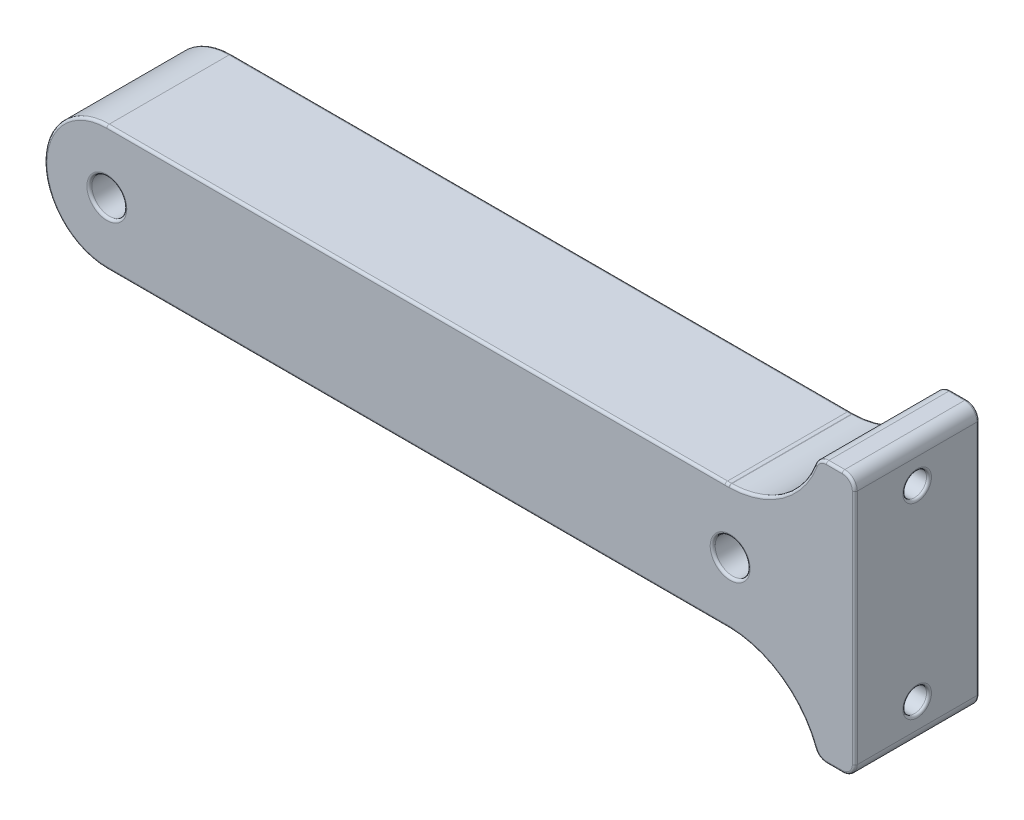
from build123d import *

# Parameters (mm, degrees)
EXTRUDE_1_DEPTH      = 5
EXTRUDE_1_DEPTH_BACK = 5
SKETCH_1_R           = 1.4
SKETCH_2_R           = 0.95
CUT_EXTRUDE_1_DEPTH  = 67.03218912
FILLET_1_R           = 0.2


with BuildPart() as part:
    # 스케치1 → 보스-돌출1 (new, two sides: drawn at the far end of the back side and taken through both)
    with BuildSketch(Plane.XY.offset(-EXTRUDE_1_DEPTH_BACK)):
        with BuildLine():
            ThreePointArc((-25, 5), (-30, 0), (-25, -5))
            Line((-25, -5), (24.593629003, -5))
            ThreePointArc((24.593629003, -5), (28.964550408, -6.279850585), (31.789043043, -9.852694383))
            ThreePointArc((31.789043043, -9.852694383), (32.155876693, -10.322403302), (32.724781613, -10.5))
            Line((32.724781613, -10.5), (34, -10.5))
            ThreePointArc((34, -10.5), (34.707106781, -10.207106781), (35, -9.5))
            Line((35, -9.5), (35, 9.5))
            ThreePointArc((35, 9.5), (34.707106781, 10.207106781), (34, 10.5))
            Line((34, 10.5), (32.724781613, 10.5))
            ThreePointArc((32.724781613, 10.5), (32.155876693, 10.322403302), (31.789043043, 9.852694383))
            ThreePointArc((31.789043043, 9.852694383), (28.964550408, 6.279850585), (24.593629003, 5))
            Line((24.593629003, 5), (-25, 5))
        make_face()
        with Locations((-25, 0)):
            Circle(SKETCH_1_R, mode=Mode.SUBTRACT)
        with Locations((25, 0)):
            Circle(SKETCH_1_R, mode=Mode.SUBTRACT)
    extrude(amount=EXTRUDE_1_DEPTH + EXTRUDE_1_DEPTH_BACK)

    # 스케치2 → 컷-돌출1 (cut, through all)
    with BuildSketch(Plane(origin=(35, 0, 0), x_dir=(0, 0, -1), z_dir=(1, 0, 0))):
        with Locations(Location((0, 7.5, 0), (0, 0, 90))):
            Circle(SKETCH_2_R)
        with Locations(Location((0, -7.5, 0), (0, 0, 90))):
            Circle(SKETCH_2_R)
    extrude(amount=-CUT_EXTRUDE_1_DEPTH, mode=Mode.SUBTRACT)

    # 필렛1
    fillet_1_edges = [part.edges().sort_by_distance(p)[0] for p in [
        (35, -8.45, 0),
        (31.084836779, -8.45, 0),
        (29.339642378, 6.55, 0),
        (35, 6.55, 0),
        (-26.4, 0, -5),
        (-26.4, 0, 5),
        (23.6, 0, -5),
        (23.6, 0, 5),
        (28.964550408, 6.279850585, 5),
        (28.964550408, 6.279850585, -5),
        (28.964550408, 6.279850585, -5),
        (28.964550408, 6.279850585, 5),
        (-0.203185498, 5, 5),
        (-0.203185498, 5, -5),
        (-30, 0, 5),
        (-30, 0, -5),
        (-0.203185498, -5, 5),
        (-0.203185498, -5, -5),
        (28.964550408, -6.279850585, 5),
        (28.964550408, -6.279850585, -5),
        (28.964550408, -6.279850585, 5),
        (28.964550408, -6.279850585, -5),
        (28.964550408, -6.279850585, 5),
        (28.964550408, -6.279850585, -5),
        (32.155876693, -10.322403302, 5),
        (32.155876693, -10.322403302, -5),
        (33.362390807, -10.5, 5),
        (33.362390807, -10.5, -5),
        (34.707106781, -10.207106781, 5),
        (34.707106781, -10.207106781, -5),
        (35, 0, 5),
        (35, 0, -5),
        (34.707106781, 10.207106781, 5),
        (34.707106781, 10.207106781, -5),
        (33.362390807, 10.5, 5),
        (33.362390807, 10.5, -5),
        (32.155876693, 10.322403302, 5),
        (32.155876693, 10.322403302, -5),
        (28.964550408, 6.279850585, -5),
        (28.964550408, 6.279850585, 5),
    ]]
    fillet(fillet_1_edges, radius=FILLET_1_R)


solid = part.part
